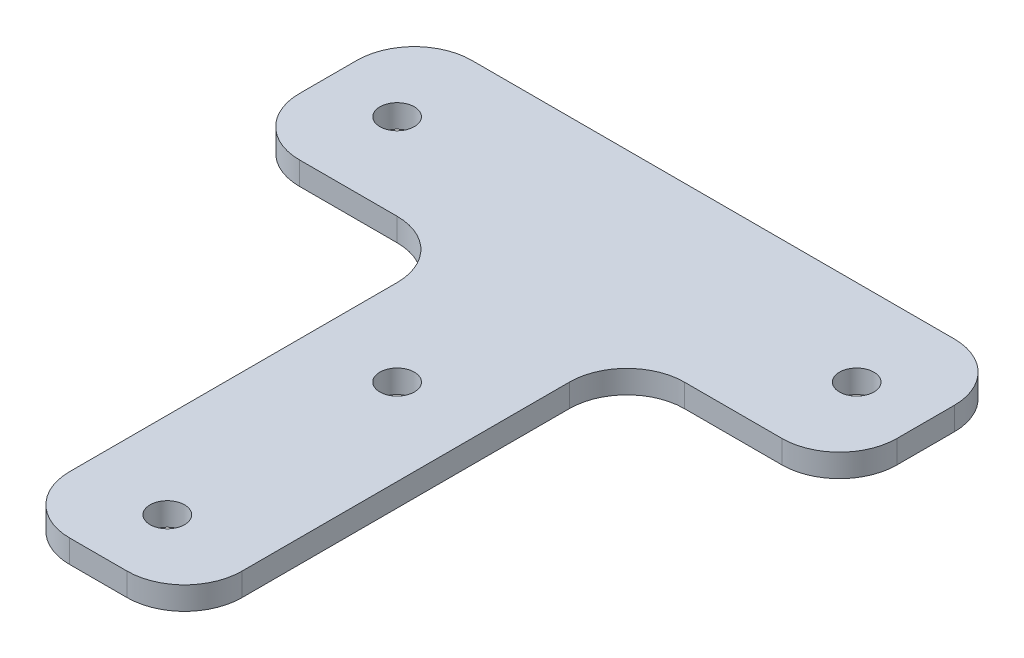
from build123d import *

# Parameters (mm, degrees)
SKETCH1_R           = 1.5
BOSS_EXTRUDE1_DEPTH = 2
FILLET1_R           = 5


with BuildPart() as part:
    # Sketch1 → Boss-Extrude1 (new body)
    with BuildSketch(Plane(origin=(0, 0, 0), x_dir=(1, 0, 0), z_dir=(0, 1, 0))):
        Polygon((7.5, -46), (7.5, -7.5), (26, -7.5), (26, 7.5), (-26, 7.5), (-26, -7.5), (-7.5, -7.5), (-7.5, -46), align=None)
        with Locations(Location((0, -40, 0), (0, 0, 270))):
            Circle(SKETCH1_R, mode=Mode.SUBTRACT)
        with Locations(Location((0, -20, 0), (0, 0, 270))):
            Circle(SKETCH1_R, mode=Mode.SUBTRACT)
        with Locations(Location((20, 0, 0), (0, 0, 270))):
            Circle(SKETCH1_R, mode=Mode.SUBTRACT)
        with Locations(Location((-20, 0, 0), (0, 0, 90))):
            Circle(SKETCH1_R, mode=Mode.SUBTRACT)
    extrude(amount=BOSS_EXTRUDE1_DEPTH)

    # Fillet1
    fillet1_edges = [part.edges().sort_by_distance(p)[0] for p in [
        (-7.5, 1, 46),
        (-7.5, 1, 7.5),
        (-26, 1, 7.5),
        (-26, 1, -7.5),
        (26, 1, -7.5),
        (26, 1, 7.5),
        (7.5, 1, 7.5),
        (7.5, 1, 46),
    ]]
    fillet(fillet1_edges, radius=FILLET1_R)


solid = part.part
